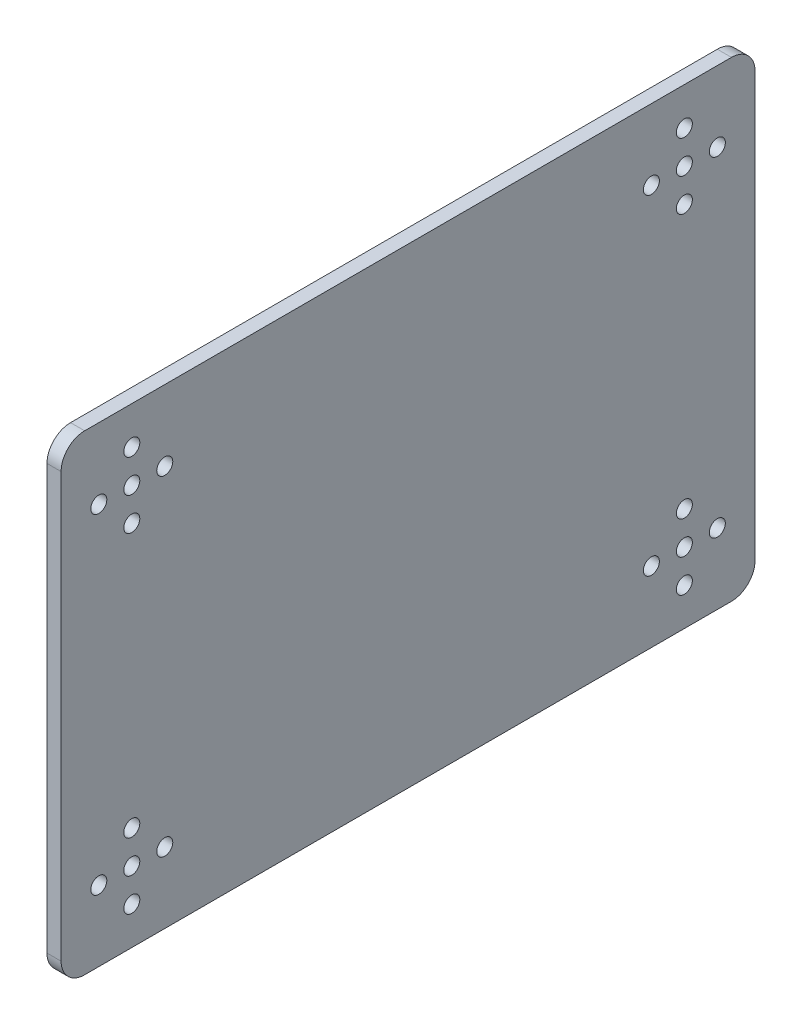
from build123d import *

# Parameters (mm, degrees)
SKETCH1_W            = 147.29
SKETCH1_H            = 100
BOSS_EXTRUDE1_DEPTH  = 3
M3_CLEARANCE_HOLE2_D = 3.4
M3_CLEARANCE_HOLE3_D = 3.4
FILLET1_R            = 5


with BuildPart() as part:
    # Sketch1 → Boss-Extrude1 (new body)
    with BuildSketch(Plane(origin=(0, 0, 0), x_dir=(0, 0, -1), z_dir=(1, 0, 0))):
        Rectangle(SKETCH1_W, SKETCH1_H)
    extrude(amount=BOSS_EXTRUDE1_DEPTH)

    # M3 Clearance Hole2 (through all)
    with Locations(Plane(origin=(3, 0, 0), x_dir=(0, 0, -1), z_dir=(1, 0, 0))):
        with Locations((58.645, -35), (51.645, -35), (58.645, -28), (65.645, -35), (58.645, -42), (58.645, 35), (58.645, 42), (51.645, 35), (58.645, 28), (65.645, 35)):
            Hole(M3_CLEARANCE_HOLE2_D / 2)

    # M3 Clearance Hole3 (through all)
    with Locations(Plane.ZY):
        with Locations((58.645, 35), (58.645, 42), (65.645, 35), (58.645, 28), (51.645, 35), (58.645, -35), (58.645, -28), (65.645, -35), (58.645, -42), (51.645, -35)):
            Hole(M3_CLEARANCE_HOLE3_D / 2)

    # Fillet1
    fillet1_edges = [part.edges().sort_by_distance(p)[0] for p in [
        (1.5, -50, -73.645),
        (1.5, -50, 73.645),
        (1.5, 50, 73.645),
        (1.5, 50, -73.645),
    ]]
    fillet(fillet1_edges, radius=FILLET1_R)


solid = part.part
